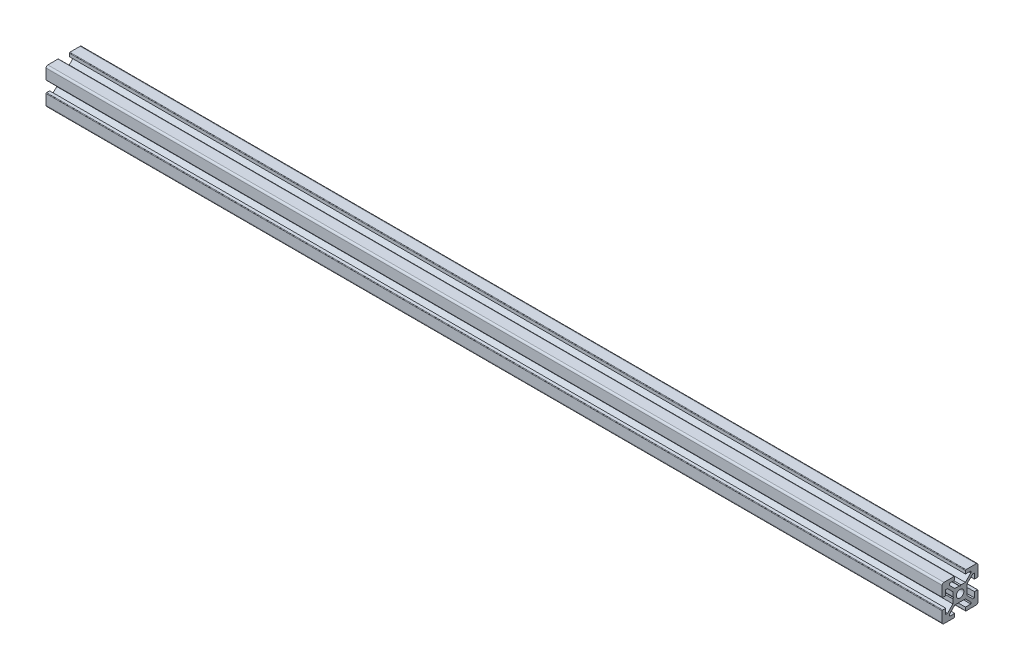
from build123d import *

# Parameters (mm, degrees)
SKETCH1_R           = 2.1
BOSS_EXTRUDE1_DEPTH = 500


with BuildPart() as part:
    # Sketch1 → Boss-Extrude1 (new body)
    with BuildSketch(Plane(origin=(0, 0, 0), x_dir=(0, 0, -1), z_dir=(1, 0, 0))):
        with BuildLine():
            Line((-9.935097613, 3.380939919), (-9.935097613, 9.080939919))
            ThreePointArc((-9.935097613, 9.080939919), (-9.642204394, 9.788046701), (-8.935097613, 10.080939919))
            Line((-8.935097613, 10.080939919), (-3.235097613, 10.080939919))
            ThreePointArc((-3.235097613, 10.080939919), (-3.022965579, 9.993071954), (-2.935097613, 9.780939919))
            Line((-2.935097613, 9.780939919), (-2.935097613, 8.080900091))
            Line((-2.935097613, 8.080900091), (-5.935097613, 8.080900091))
            Line((-5.935097613, 8.080900091), (-5.935097613, 7.141600091))
            Line((-5.935097613, 7.141600091), (-2.874424271, 4.080926749))
            Line((-2.874424271, 4.080926749), (-0.454699685, 4.080926749))
            Line((-0.454699685, 4.080926749), (0.064915557, 3.780926749))
            Line((0.064915557, 3.780926749), (0.5845308, 4.080926749))
            Line((0.5845308, 4.080926749), (3.004255385, 4.080926749))
            Line((3.004255385, 4.080926749), (6.064928728, 7.141600091))
            Line((6.064928728, 7.141600091), (6.064928728, 8.080900091))
            Line((6.064928728, 8.080900091), (3.064928728, 8.080900091))
            Line((3.064928728, 8.080900091), (3.064928728, 9.780939919))
            ThreePointArc((3.064928728, 9.780939919), (3.152796693, 9.993071954), (3.364928728, 10.080939919))
            Line((3.364928728, 10.080939919), (9.064928728, 10.080939919))
            ThreePointArc((9.064928728, 10.080939919), (9.772035509, 9.788046701), (10.064928728, 9.080939919))
            Line((10.064928728, 9.080939919), (10.064928728, 3.380939919))
            ThreePointArc((10.064928728, 3.380939919), (9.977060762, 3.168807885), (9.764928728, 3.080939919))
            Line((9.764928728, 3.080939919), (8.064888899, 3.080939919))
            Line((8.064888899, 3.080939919), (8.064888899, 6.080939919))
            Line((8.064888899, 6.080939919), (7.125588899, 6.080939919))
            Line((7.125588899, 6.080939919), (4.064915557, 3.020266577))
            Line((4.064915557, 3.020266577), (4.064915557, 0.600541991))
            Line((4.064915557, 0.600541991), (3.764915557, 0.080926749))
            Line((3.764915557, 0.080926749), (4.064915557, -0.438688493))
            Line((4.064915557, -0.438688493), (4.064915557, -2.858413079))
            Line((4.064915557, -2.858413079), (7.125588899, -5.919086421))
            Line((7.125588899, -5.919086421), (8.064888899, -5.919086421))
            Line((8.064888899, -5.919086421), (8.064888899, -2.919086421))
            Line((8.064888899, -2.919086421), (9.764928728, -2.919086421))
            ThreePointArc((9.764928728, -2.919086421), (9.977060762, -3.006954387), (10.064928728, -3.219086421))
            Line((10.064928728, -3.219086421), (10.064928728, -8.919086421))
            ThreePointArc((10.064928728, -8.919086421), (9.772035509, -9.626193203), (9.064928728, -9.919086421))
            Line((9.064928728, -9.919086421), (3.364928728, -9.919086421))
            ThreePointArc((3.364928728, -9.919086421), (3.152796693, -9.831218456), (3.064928728, -9.619086421))
            Line((3.064928728, -9.619086421), (3.064928728, -7.919046593))
            Line((3.064928728, -7.919046593), (6.064928728, -7.919046593))
            Line((6.064928728, -7.919046593), (6.064928728, -6.979746593))
            Line((6.064928728, -6.979746593), (3.004255385, -3.919073251))
            Line((3.004255385, -3.919073251), (0.5845308, -3.919073251))
            Line((0.5845308, -3.919073251), (0.064915557, -3.619073251))
            Line((0.064915557, -3.619073251), (-0.454699685, -3.919073251))
            Line((-0.454699685, -3.919073251), (-2.874424271, -3.919073251))
            Line((-2.874424271, -3.919073251), (-5.935097613, -6.979746593))
            Line((-5.935097613, -6.979746593), (-5.935097613, -7.919046593))
            Line((-5.935097613, -7.919046593), (-2.935097613, -7.919046593))
            Line((-2.935097613, -7.919046593), (-2.935097613, -9.619086421))
            ThreePointArc((-2.935097613, -9.619086421), (-3.022965579, -9.831218456), (-3.235097613, -9.919086421))
            Line((-3.235097613, -9.919086421), (-8.935097613, -9.919086421))
            ThreePointArc((-8.935097613, -9.919086421), (-9.642204394, -9.626193203), (-9.935097613, -8.919086421))
            Line((-9.935097613, -8.919086421), (-9.935097613, -3.219086421))
            ThreePointArc((-9.935097613, -3.219086421), (-9.847229647, -3.006954387), (-9.635097613, -2.919086421))
            Line((-9.635097613, -2.919086421), (-7.935057785, -2.919086421))
            Line((-7.935057785, -2.919086421), (-7.935057785, -5.919086421))
            Line((-7.935057785, -5.919086421), (-6.995757785, -5.919086421))
            Line((-6.995757785, -5.919086421), (-3.935084443, -2.858413079))
            Line((-3.935084443, -2.858413079), (-3.935084443, -0.438688493))
            Line((-3.935084443, -0.438688493), (-3.635084443, 0.080926749))
            Line((-3.635084443, 0.080926749), (-3.935084443, 0.600541991))
            Line((-3.935084443, 0.600541991), (-3.935084443, 3.020266577))
            Line((-3.935084443, 3.020266577), (-6.995757785, 6.080939919))
            Line((-6.995757785, 6.080939919), (-7.935057785, 6.080939919))
            Line((-7.935057785, 6.080939919), (-7.935057785, 3.080939919))
            Line((-7.935057785, 3.080939919), (-9.635097613, 3.080939919))
            ThreePointArc((-9.635097613, 3.080939919), (-9.847229647, 3.168807885), (-9.935097613, 3.380939919))
        make_face()
        with Locations((0.064915557, 0.080926749)):
            Circle(SKETCH1_R, mode=Mode.SUBTRACT)
    extrude(amount=BOSS_EXTRUDE1_DEPTH)


solid = part.part
